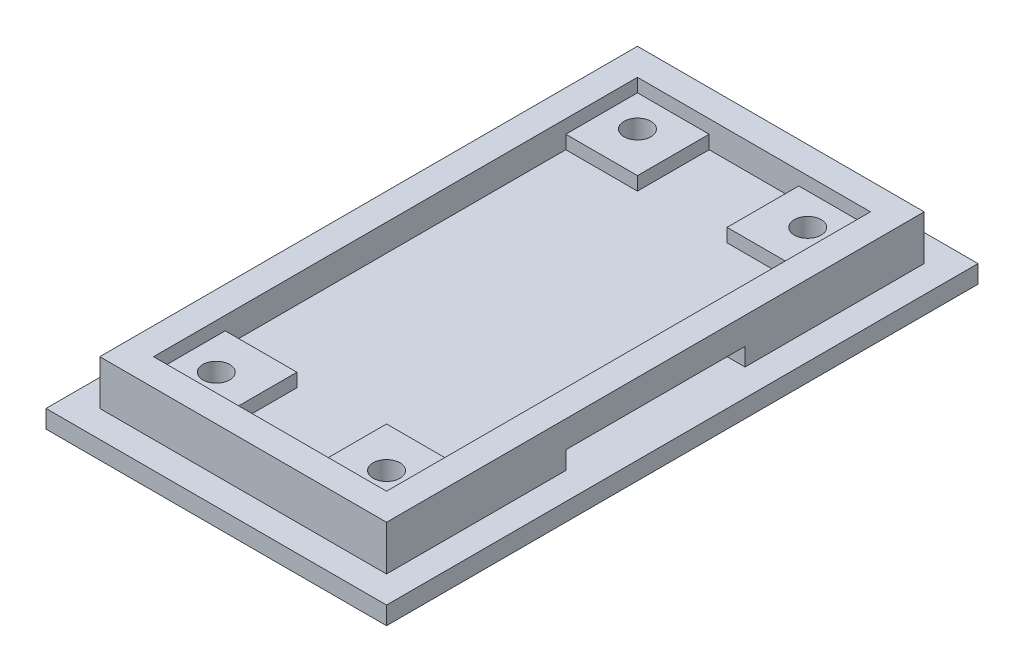
from build123d import *

# Parameters (mm, degrees)
SKETCH1_W           = 32
SKETCH1_H           = 60
BOSS_EXTRUDE1_DEPTH = 5
SKETCH2_W           = 26
SKETCH2_H           = 54
CUT_EXTRUDE1_DEPTH  = 3
SKETCH6_W           = 20
SKETCH6_H           = 2
CUT_EXTRUDE4_DEPTH  = 2
SKETCH7_W           = 38
SKETCH7_H           = 66
BOSS_EXTRUDE3_DEPTH = 2
SKETCH4_W           = 8
SKETCH4_H           = 8
BOSS_EXTRUDE2_DEPTH = 1.5
SKETCH3_R           = 1.5
CUT_EXTRUDE2_DEPTH  = 5.5


with BuildPart() as part:
    # Sketch1 → Boss-Extrude1 (new body)
    with BuildSketch(Plane(origin=(0, 0, 0), x_dir=(1, 0, 0), z_dir=(0, 1, 0))):
        Rectangle(SKETCH1_W, SKETCH1_H)
    extrude(amount=BOSS_EXTRUDE1_DEPTH)

    # Sketch2 → Cut-Extrude1 (cut)
    with BuildSketch(Plane(origin=(0, 5, 0), x_dir=(1, 0, 0), z_dir=(0, 1, 0))):
        Rectangle(SKETCH2_W, SKETCH2_H)
    extrude(amount=-CUT_EXTRUDE1_DEPTH, mode=Mode.SUBTRACT)

    # Sketch6 → Cut-Extrude4 (cut)
    with BuildSketch(Plane(origin=(16, 0, -14), x_dir=(0, 0, 1), z_dir=(-1, 0, 0))):
        with Locations((14, 1)):
            Rectangle(SKETCH6_W, SKETCH6_H)
    cut_extrude4 = extrude(amount=CUT_EXTRUDE4_DEPTH, mode=Mode.SUBTRACT)

    # Sketch7 → Boss-Extrude3 (add)
    with BuildSketch(Plane.XZ):
        Rectangle(SKETCH7_W, SKETCH7_H)
    extrude(amount=BOSS_EXTRUDE3_DEPTH)

    # Sketch4 → Boss-Extrude2 (add)
    with BuildSketch(Plane(origin=(0, 2, 0), x_dir=(1, 0, 0), z_dir=(0, 1, 0))):
        with Locations((9, 23)):
            Rectangle(SKETCH4_W, SKETCH4_H)
        with Locations((-9, 23)):
            Rectangle(SKETCH4_W, SKETCH4_H)
        with Locations((9, -23)):
            Rectangle(SKETCH4_W, SKETCH4_H)
        with Locations((-9, -23)):
            Rectangle(SKETCH4_W, SKETCH4_H)
    extrude(amount=BOSS_EXTRUDE2_DEPTH)

    # Sketch3 → Cut-Extrude2 (cut)
    with BuildSketch(Plane(origin=(0, 3.5, 0), x_dir=(1, 0, 0), z_dir=(0, 1, 0))):
        with Locations(Location((-9.5, 23.5, 0), (0, 0, 270))):
            Circle(SKETCH3_R)
        with Locations(Location((9.5, 23.5, 0), (0, 0, 270))):
            Circle(SKETCH3_R)
        with Locations(Location((9.5, -23.5, 0), (0, 0, 270))):
            Circle(SKETCH3_R)
        with Locations(Location((-9.5, -23.5, 0), (0, 0, 270))):
            Circle(SKETCH3_R)
    extrude(amount=-CUT_EXTRUDE2_DEPTH, mode=Mode.SUBTRACT)

    # Mirror1: Cut-Extrude4 across plane
    add(cut_extrude4.mirror(Plane(origin=(0, 0, 0), x_dir=(0, 0, 1), z_dir=(1, 0, 0))), mode=Mode.SUBTRACT)


solid = part.part
